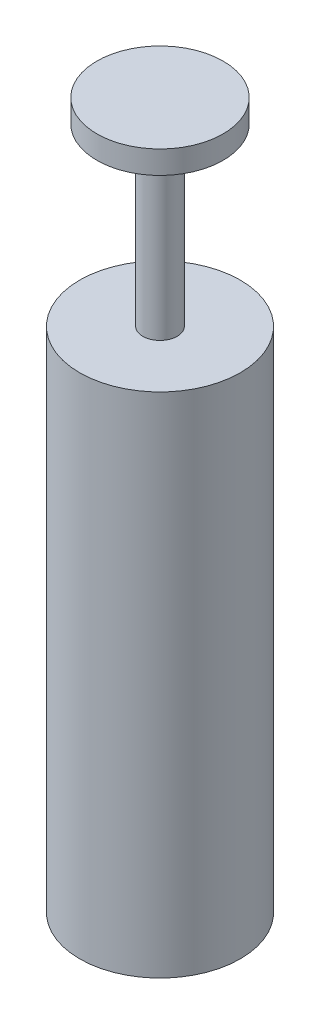
from build123d import *


with BuildPart() as part:
    # Sketch1 → Revolve1 (revolve)
    with BuildSketch(Plane(origin=(0, 0, 0), x_dir=(0, 0, -1), z_dir=(1, 0, 0))):
        Polygon((0, 195.326), (17.4625, 195.326), (17.4625, 188.976), (4.7625, 188.976), (4.7625, 140.462), (22.225, 140.462), (22.225, 0), (0, 0), align=None)
    revolve(axis=Axis((0, 0, 0), (0, 1, 0)))


solid = part.part
